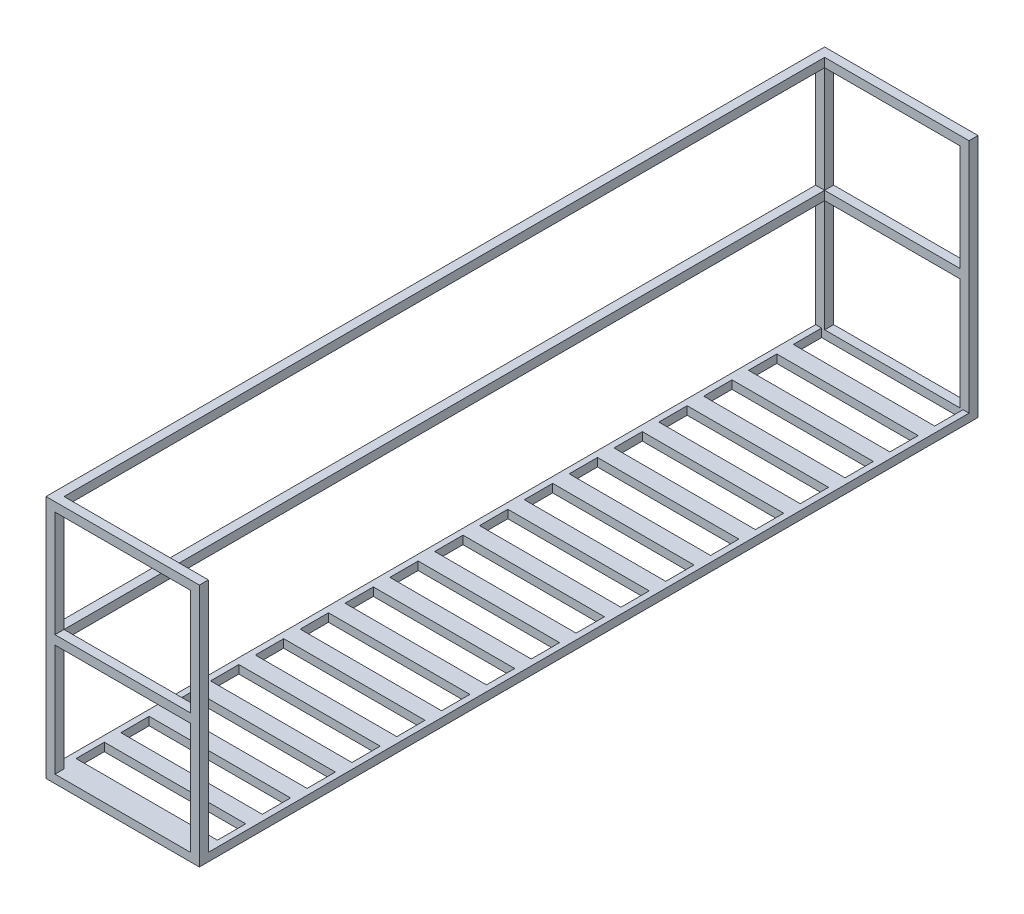
from build123d import *

# Parameters (mm, degrees)
CROQUIS1_W              = 650
CROQUIS1_H              = 35
SALIENTE_EXTRUIR1_DEPTH = 3300
CROQUIS2_W              = 599.2
CROQUIS2_H              = 120
CORTAR_EXTRUIR1_DEPTH   = 3000
MATRIZL1_COUNT          = 17
MATRIZL1_PITCH          = 190
CROQUIS3_W              = 38.1
CROQUIS3_H              = 38.1
SALIENTE_EXTRUIR2_DEPTH = 1000
CROQUIS4_W              = 38.1
CROQUIS4_H              = 38.1
SALIENTE_EXTRUIR3_DEPTH = 3250
CROQUIS5_W              = 38.1
CROQUIS5_H              = 38.1
SALIENTE_EXTRUIR4_DEPTH = 3250
CROQUIS6_W              = 38.1
CROQUIS6_H              = 38.1
SALIENTE_EXTRUIR5_DEPTH = 630
CROQUIS7_W              = 38.1
CROQUIS7_H              = 38.1
SALIENTE_EXTRUIR6_DEPTH = 630
CROQUIS8_W              = 38.1
CROQUIS8_H              = 38.1
SALIENTE_EXTRUIR7_DEPTH = 630


with BuildPart() as part:
    # Croquis1 → Saliente-Extruir1 (new body)
    with BuildSketch(Plane.XY):
        with Locations((325, 17.5)):
            Rectangle(CROQUIS1_W, CROQUIS1_H)
    extrude(amount=SALIENTE_EXTRUIR1_DEPTH)

    # Croquis2 → Cortar-Extruir1 (cut)
    with BuildSketch(Plane(origin=(0, 35, 0), x_dir=(1, 0, 0), z_dir=(0, 1, 0))):
        with Locations((325, -98.1)):
            Rectangle(CROQUIS2_W, CROQUIS2_H)
    cortar_extruir1 = extrude(amount=-CORTAR_EXTRUIR1_DEPTH, mode=Mode.SUBTRACT)

    # MatrizL1: Cortar-Extruir1 ×17
    with Locations(*[(0, 0, i * MATRIZL1_PITCH) for i in range(1, MATRIZL1_COUNT)]):
        add(cortar_extruir1, mode=Mode.SUBTRACT)

    # Croquis3 → Saliente-Extruir2 (add)
    with BuildSketch(Plane(origin=(0, 35, 0), x_dir=(1, 0, 0), z_dir=(0, 1, 0))):
        with Locations((19.05, -3280.95)):
            Rectangle(CROQUIS3_W, CROQUIS3_H)
        with Locations((630.95, -3280.95)):
            Rectangle(CROQUIS3_W, CROQUIS3_H)
        with Locations((19.05, -19.05)):
            Rectangle(CROQUIS3_W, CROQUIS3_H)
        with Locations((630.95, -19.05)):
            Rectangle(CROQUIS3_W, CROQUIS3_H)
    extrude(amount=SALIENTE_EXTRUIR2_DEPTH)

    # Croquis4 → Saliente-Extruir3 (add)
    with BuildSketch(Plane.XY.offset(38.1)):
        with Locations((19.05, 1015.95)):
            Rectangle(CROQUIS4_W, CROQUIS4_H)
    extrude(amount=SALIENTE_EXTRUIR3_DEPTH)

    # Croquis5 → Saliente-Extruir4 (add)
    with BuildSketch(Plane.XY.offset(38.1)):
        with Locations((19.05, 527.85)):
            Rectangle(CROQUIS5_W, CROQUIS5_H)
    extrude(amount=SALIENTE_EXTRUIR4_DEPTH)

    # Croquis6 → Saliente-Extruir5 (add)
    with BuildSketch(Plane(origin=(650, 0, 0), x_dir=(0, 0, -1), z_dir=(1, 0, 0))):
        with Locations((-19.05, 1015.95)):
            Rectangle(CROQUIS6_W, CROQUIS6_H)
    extrude(amount=-SALIENTE_EXTRUIR5_DEPTH)

    # Croquis7 → Saliente-Extruir6 (add)
    with BuildSketch(Plane(origin=(650, 0, 0), x_dir=(0, 0, -1), z_dir=(1, 0, 0))):
        with Locations((-3280.95, 1015.95)):
            Rectangle(CROQUIS7_W, CROQUIS7_H)
    extrude(amount=-SALIENTE_EXTRUIR6_DEPTH)

    # Croquis8 → Saliente-Extruir7 (add)
    with BuildSketch(Plane(origin=(650, 0, 0), x_dir=(0, 0, -1), z_dir=(1, 0, 0))):
        with Locations((-19.05, 527.85)):
            Rectangle(CROQUIS8_W, CROQUIS8_H)
        with Locations((-3280.95, 527.85)):
            Rectangle(CROQUIS8_W, CROQUIS8_H)
    extrude(amount=-SALIENTE_EXTRUIR7_DEPTH)


solid = part.part
